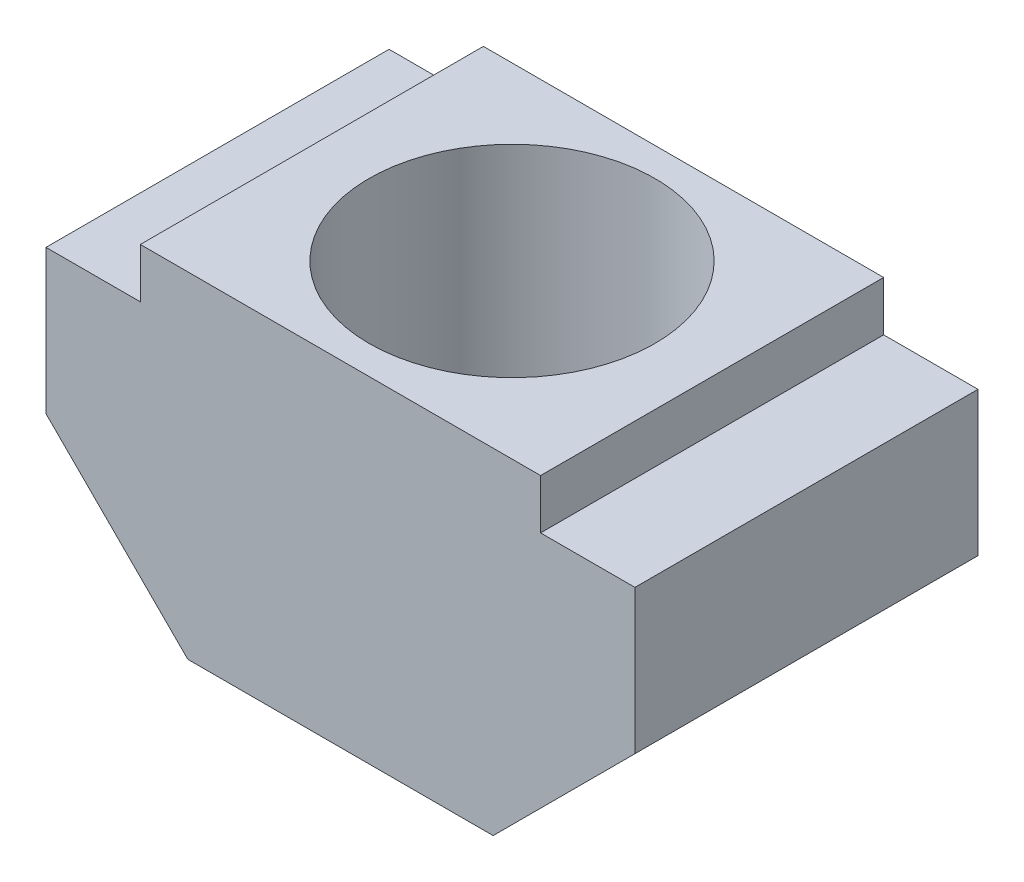
from build123d import *

# Parameters (mm, degrees)
BOSS_EXTRUDE1_DEPTH = 6
SKETCH2_R           = 2.5
CUT_EXTRUDE1_DEPTH  = 10.847197304


with BuildPart() as part:
    # Sketch1 → Boss-Extrude1 (new body)
    with BuildSketch(Plane.XY):
        Polygon((2.669921309, 0), (-2.669921309, 0), (-5.15, 2.480078691), (-5.15, 5), (-3.5, 5), (-3.5, 5.868968797), (3.5, 5.868968797), (3.5, 5), (5.15, 5), (5.15, 2.480078691), align=None)
    extrude(amount=BOSS_EXTRUDE1_DEPTH)

    # Sketch2 → Cut-Extrude1 (cut, through all)
    with BuildSketch(Plane(origin=(0, 5.868968797, 0), x_dir=(1, 0, 0), z_dir=(0, 1, 0))):
        with Locations(Location((0, -3, 0), (0, 0, 270))):
            Circle(SKETCH2_R)
    extrude(amount=-CUT_EXTRUDE1_DEPTH, mode=Mode.SUBTRACT)


solid = part.part
